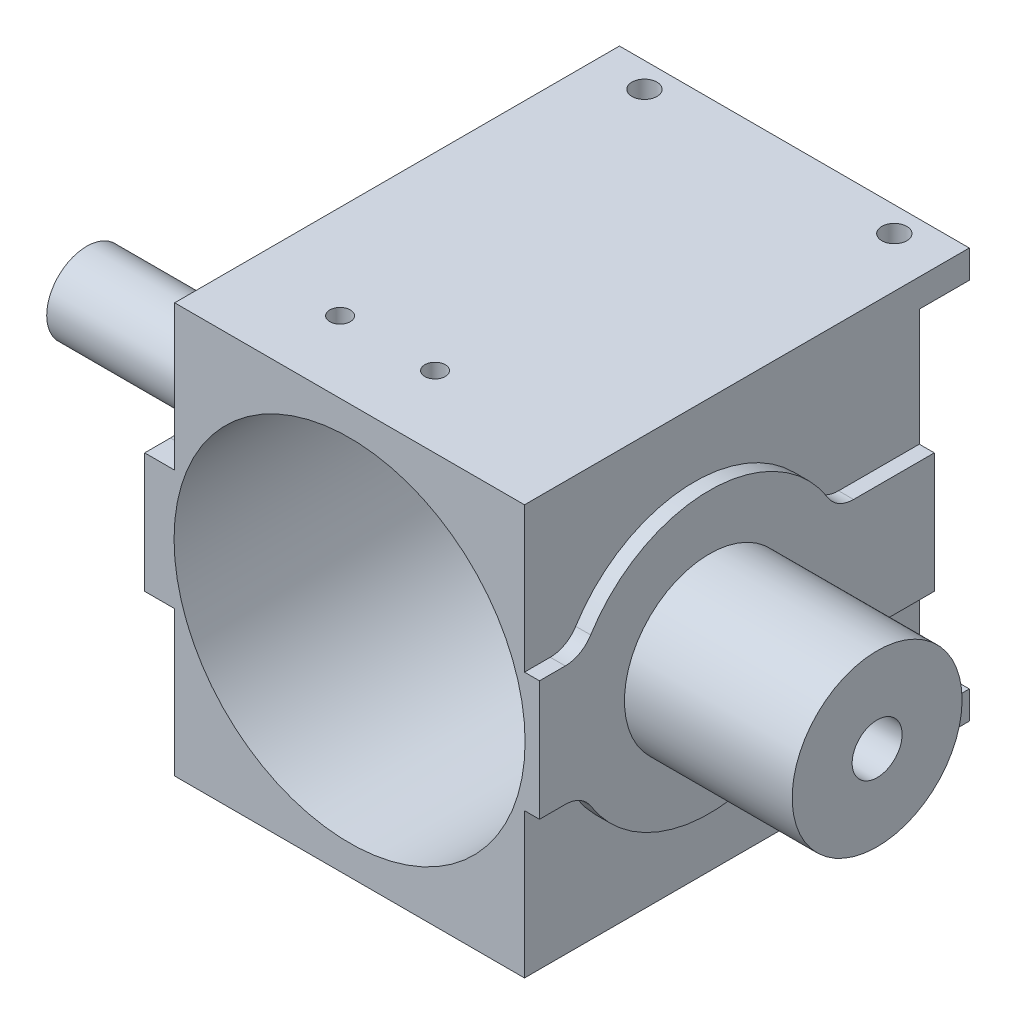
from build123d import *

# Parameters (mm, degrees)
BOSS_EXTRUDE1_DEPTH             = 44.5
BOSS_EXTRUDE2_REACH             = 63.096
SKETCH3_R                       = 14
BOSS_EXTRUDE2_DIRECTION_2_REACH = 63.096
SKETCH5_R                       = 17.56
CUT_EXTRUDE2_DEPTH              = 54.110733378
SKETCH6_W                       = 5
SKETCH6_H                       = 35.4
CUT_EXTRUDE3_DEPTH              = 63.934489749
FILLET1_R                       = 3
SKETCH7_R                       = 8.5
BOSS_EXTRUDE4_DEPTH             = 16.78
SKETCH8_R                       = 4
BOSS_EXTRUDE5_DEPTH             = 22.8
CHAMFER1_SIZE                   = 1
M3X0_5_TAPPED_HOLE1_D           = 2.5
M2_5X0_45_TAPPED_HOLE1_REACH    = 76.405
M2_5X0_45_TAPPED_HOLE1_BORE_R   = 1.025
M6X1_0_TAPPED_HOLE1_D           = 5
M6X1_0_TAPPED_HOLE1_DEPTH       = 10
M6X1_0_TAPPED_HOLE1_TIP         = 1.502151548
SKETCH16_R                      = 4
CUT_EXTRUDE4_DEPTH              = 4


with BuildPart() as part:
    # Sketch1 → Boss-Extrude1 (new body)
    with BuildSketch(Plane.XY):
        Polygon((-17.5, 20.5), (17.5, 20.5), (17.5, 6), (19, 6), (19, -6), (17.5, -6), (17.5, -20.5), (-17.5, -20.5), (-17.5, -6), (-20.5, -6), (-20.5, 6), (-17.5, 6), align=None)
    extrude(amount=BOSS_EXTRUDE1_DEPTH)

    # Boss-Extrude2: up to this face of the body (flat: up to its plane)
    boss_extrude2_end = Plane(part.part.faces().sort_by_distance((-20.5, 0, 22.25))[0])
    # Sketch3 → Boss-Extrude2 (add, up to the picked face)
    with BuildSketch(Plane.ZY.offset(17.5), mode=Mode.PRIVATE) as boss_extrude2_sk1:
        with Locations((27.5, 0)):
            Circle(SKETCH3_R)
    boss_extrude2_tool1 = split(extrude(boss_extrude2_sk1.sketch, amount=BOSS_EXTRUDE2_REACH, mode=Mode.PRIVATE), bisect_by=boss_extrude2_end, keep=Keep.BOTH, mode=Mode.PRIVATE)
    add(boss_extrude2_tool1.solids().sort_by(Axis((-17.5, 0, 27.5), (-1, 0, 0)))[0])

    # Boss-Extrude2 direction 2: up to this face of the body (flat: up to its plane)
    boss_extrude2_direction_2_end = Plane(part.part.faces().sort_by_distance((19, 0, 22.25))[0])
    # Sketch3 → Boss-Extrude2 direction 2 (add, up to the picked face)
    with BuildSketch(Plane.ZY.offset(17.5), mode=Mode.PRIVATE) as boss_extrude2_direction_2_sk1:
        with Locations((27.5, 0)):
            Circle(SKETCH3_R)
    boss_extrude2_direction_2_tool1 = split(extrude(boss_extrude2_direction_2_sk1.sketch, amount=-BOSS_EXTRUDE2_DIRECTION_2_REACH, mode=Mode.PRIVATE), bisect_by=boss_extrude2_direction_2_end, keep=Keep.BOTH, mode=Mode.PRIVATE)
    add(boss_extrude2_direction_2_tool1.solids().sort_by(Axis((-17.5, 0, 27.5), (1, 0, 0)))[0])

    # Sketch5 → Cut-Extrude2 (cut, through all)
    with BuildSketch(Plane.XY.offset(44.5)):
        Circle(SKETCH5_R)
    extrude(amount=-CUT_EXTRUDE2_DEPTH, mode=Mode.SUBTRACT)

    # Sketch6 → Cut-Extrude3 (cut, through all)
    with BuildSketch(Plane.ZY.offset(20.5)):
        with Locations((2.5, 0)):
            Rectangle(SKETCH6_W, SKETCH6_H)
    extrude(amount=-CUT_EXTRUDE3_DEPTH, mode=Mode.SUBTRACT)

    # Fillet1
    fillet1_edges = [part.edges().sort_by_distance(p)[0] for p in [
        (18.25, -6, 40.149110641),
        (18.25, -6, 14.850889359),
        (18.25, 6, 14.850889359),
        (18.25, 6, 40.149110641),
        (-19, 6, 14.850889359),
        (-19, 6, 40.149110641),
        (-19, -6, 40.149110641),
        (-19, -6, 14.850889359),
    ]]
    fillet(fillet1_edges, radius=FILLET1_R)

    # Sketch7 → Boss-Extrude4 (add)
    with BuildSketch(Plane(origin=(19, 0, 0), x_dir=(0, 0, -1), z_dir=(1, 0, 0))):
        with Locations((-27.5, 0)):
            Circle(SKETCH7_R)
    extrude(amount=BOSS_EXTRUDE4_DEPTH)

    # Sketch8 → Boss-Extrude5 (add)
    with BuildSketch(Plane.ZY.offset(20.5)):
        with Locations((27.5, 0)):
            Circle(SKETCH8_R)
    extrude(amount=BOSS_EXTRUDE5_DEPTH)

    # Chamfer1
    chamfer1_edges = [part.edges().sort_by_distance(p)[0] for p in [
        (-20.5, 0, 23.5),
    ]]
    chamfer(chamfer1_edges, length=CHAMFER1_SIZE)

    # M3x0.5 Tapped Hole1 (through all)
    with Locations(Plane(origin=(0, -20.5, 0), x_dir=(-1, 0, 0), z_dir=(0, -1, 0))):
        with Locations((-12.5, -2.5), (12.5, -2.5)):
            Hole(M3X0_5_TAPPED_HOLE1_D / 2)

    # M2.5x0.45 Tapped Hole1 bore → M2.5x0.45 Tapped Hole1 (cut, up to next)
    with BuildSketch(Plane(origin=(0, 20.5, 0), x_dir=(1, 0, 0), z_dir=(0, 1, 0)), mode=Mode.PRIVATE) as m2_5x0_45_tapped_hole1_sk1:
        with Locations((-8.1, -37.35)):
            Circle(M2_5X0_45_TAPPED_HOLE1_BORE_R)
    m2_5x0_45_tapped_hole1_tool1 = extrude(m2_5x0_45_tapped_hole1_sk1.sketch, amount=-M2_5X0_45_TAPPED_HOLE1_REACH, mode=Mode.PRIVATE) & part.part
    # M2.5x0.45 Tapped Hole1 bore → M2.5x0.45 Tapped Hole1 (cut, up to next)
    with BuildSketch(Plane(origin=(0, 20.5, 0), x_dir=(1, 0, 0), z_dir=(0, 1, 0)), mode=Mode.PRIVATE) as m2_5x0_45_tapped_hole1_sk2:
        with Locations((1.4, -37.35)):
            Circle(M2_5X0_45_TAPPED_HOLE1_BORE_R)
    m2_5x0_45_tapped_hole1_tool2 = extrude(m2_5x0_45_tapped_hole1_sk2.sketch, amount=-M2_5X0_45_TAPPED_HOLE1_REACH, mode=Mode.PRIVATE) & part.part
    add(m2_5x0_45_tapped_hole1_tool1.solids().sort_by_distance((-8.1, 20.5, 37.35))[0], mode=Mode.SUBTRACT)
    add(m2_5x0_45_tapped_hole1_tool2.solids().sort_by_distance((1.4, 20.5, 37.35))[0], mode=Mode.SUBTRACT)

    # M6x1.0 Tapped Hole1
    with Locations(Plane(origin=(35.78, 0, 0), x_dir=(0, 0, -1), z_dir=(1, 0, 0))):
        with Locations((-27.5, 0)):
            Hole(M6X1_0_TAPPED_HOLE1_D / 2, depth=M6X1_0_TAPPED_HOLE1_DEPTH)
            with Locations((0, 0, -(M6X1_0_TAPPED_HOLE1_DEPTH + M6X1_0_TAPPED_HOLE1_TIP / 2))):  # 118° drill point
                Cone(0, M6X1_0_TAPPED_HOLE1_D / 2, M6X1_0_TAPPED_HOLE1_TIP, mode=Mode.SUBTRACT)

    # Sketch16 → Cut-Extrude4 (cut)
    with BuildSketch(Plane(origin=(0, 0, 5), x_dir=(-1, 0, 0), z_dir=(0, 0, -1))):
        with Locations((12.346045823, 12.48714349)):
            Circle(SKETCH16_R)
        with Locations((12.522297379, -12.310490175)):
            Circle(SKETCH16_R)
        with Locations((-12.275336286, -12.486741731)):
            Circle(SKETCH16_R)
        with Locations((-12.451587842, 12.310891934)):
            Circle(SKETCH16_R)
    extrude(amount=-CUT_EXTRUDE4_DEPTH, mode=Mode.SUBTRACT)


solid = part.part
